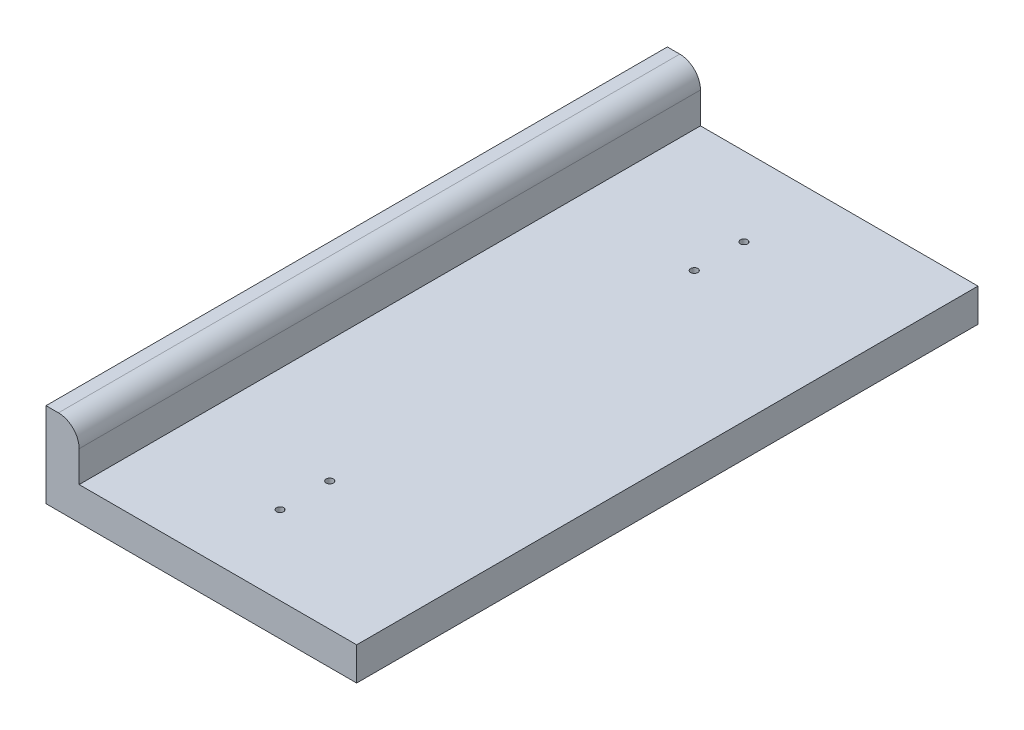
from build123d import *

# Parameters (mm, degrees)
SKETCH1_W             = 150
SKETCH1_H             = 300
BOSS_EXTRUDE1_DEPTH   = 16
SKETCH2_W             = 16
SKETCH2_H             = 300
BOSS_EXTRUDE2_DEPTH   = 25
FILLET1_R             = 10
F_8_36_TAPPED_HOLE1_D = 3.4544


with BuildPart() as part:
    # Sketch1 → Boss-Extrude1 (new body)
    with BuildSketch(Plane(origin=(0, 0, 0), x_dir=(1, 0, 0), z_dir=(0, 1, 0))):
        Rectangle(SKETCH1_W, SKETCH1_H)
    extrude(amount=BOSS_EXTRUDE1_DEPTH)

    # Sketch2 → Boss-Extrude2 (add)
    with BuildSketch(Plane(origin=(0, 16, 0), x_dir=(1, 0, 0), z_dir=(0, 1, 0))):
        with Locations((-67, 0)):
            Rectangle(SKETCH2_W, SKETCH2_H)
    extrude(amount=BOSS_EXTRUDE2_DEPTH)

    # Fillet1
    fillet1_edges = [part.edges().sort_by_distance(p)[0] for p in [
        (-59, 41, 0),
    ]]
    fillet(fillet1_edges, radius=FILLET1_R)

    # #8-36 Tapped Hole1 (through all)
    with Locations(Plane(origin=(0, 0, 0), x_dir=(-1, 0, 0), z_dir=(0, -1, 0))):
        with Locations((0, 112), (0, 88)):
            f_8_36_tapped_hole1 = Hole(F_8_36_TAPPED_HOLE1_D / 2)

    # Mirror1: #8-36 Tapped Hole1 across plane
    add(f_8_36_tapped_hole1.mirror(Plane.XY), mode=Mode.SUBTRACT)


solid = part.part
